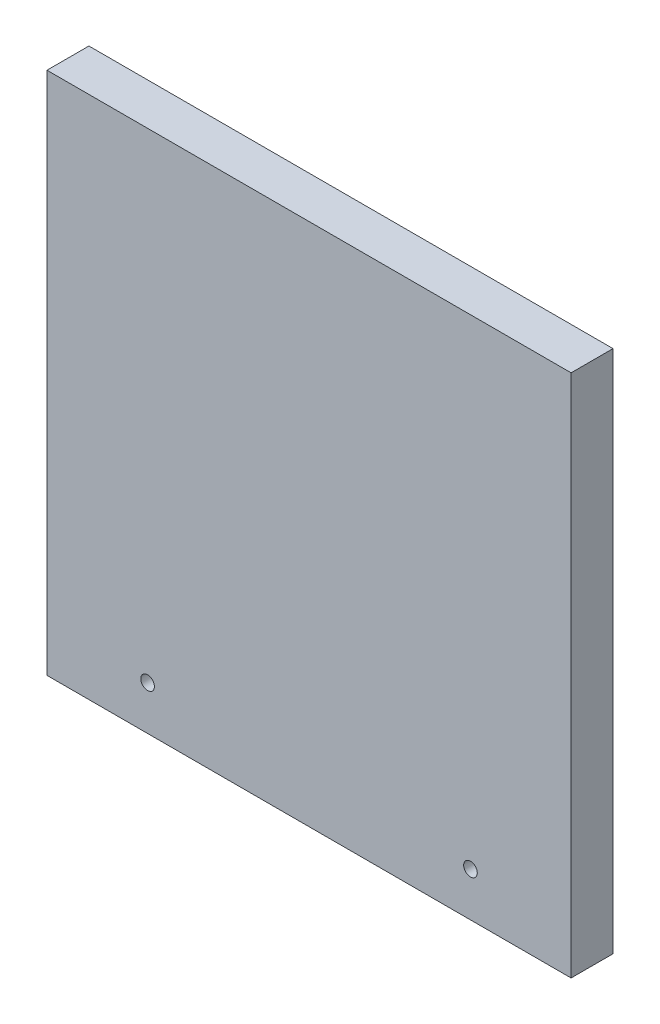
from build123d import *

# Parameters (mm, degrees)
CROQUIS1_W              = 250
CROQUIS1_H              = 20
SALIENTE_EXTRUIR1_DEPTH = 250
CROQUIS2_R              = 3.25
CORTAR_EXTRUIR1_DEPTH   = 281.223125384


with BuildPart() as part:
    # Croquis1 → Saliente-Extruir1 (new body)
    with BuildSketch(Plane(origin=(0, 0, 0), x_dir=(1, 0, 0), z_dir=(0, 1, 0))):
        with Locations((0, 185.6)):
            Rectangle(CROQUIS1_W, CROQUIS1_H)
    extrude(amount=SALIENTE_EXTRUIR1_DEPTH)

    # Croquis2 → Cortar-Extruir1 (cut, through all)
    with BuildSketch(Plane.XY.offset(-175.6)):
        with Locations((-77, 21)):
            Circle(CROQUIS2_R)
        with Locations(Location((77, 21, 0), (0, 0, 180))):
            Circle(CROQUIS2_R)
    extrude(amount=-CORTAR_EXTRUIR1_DEPTH, mode=Mode.SUBTRACT)


solid = part.part
